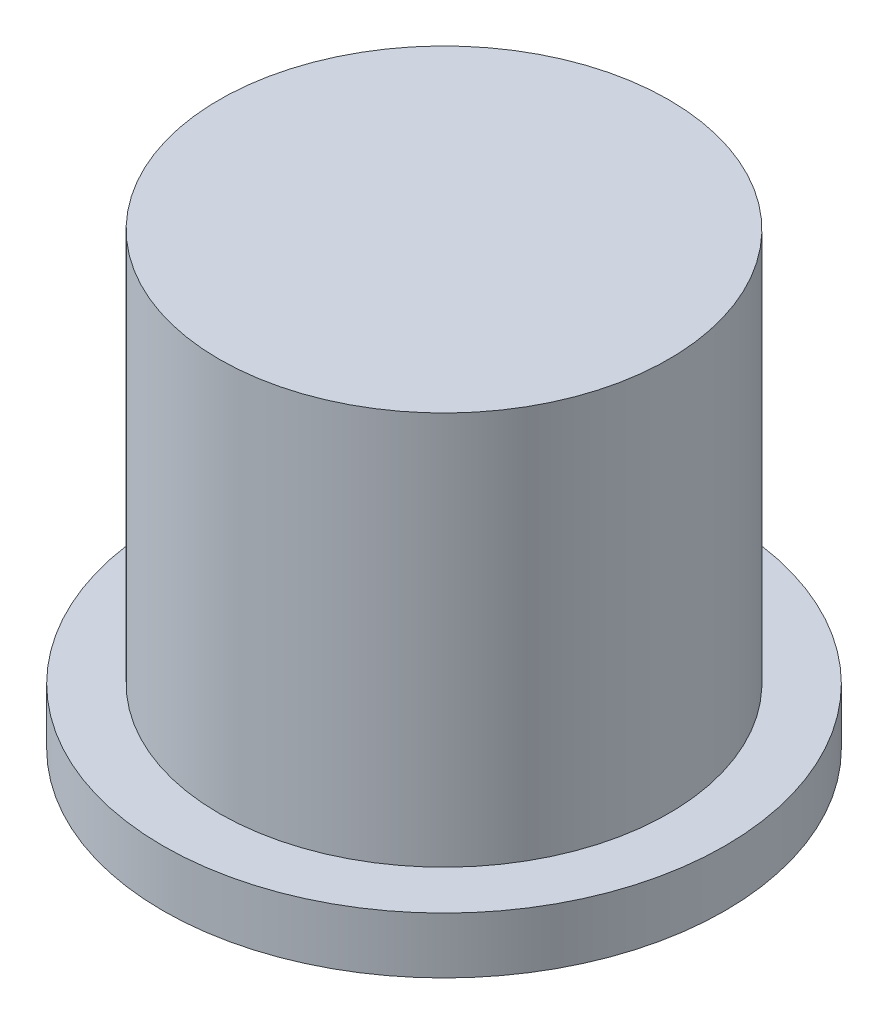
from build123d import *

# Parameters (mm, degrees)
SKETCH1_R           = 10
BOSS_EXTRUDE1_DEPTH = 2
SKETCH2_R           = 8
BOSS_EXTRUDE2_DEPTH = 14


with BuildPart() as part:
    # Sketch1 → Boss-Extrude1 (new body)
    with BuildSketch(Plane(origin=(0, 0, 0), x_dir=(1, 0, 0), z_dir=(0, 1, 0))):
        with Locations(Location((0, 0, 0), (0, 0, 270))):
            Circle(SKETCH1_R)
    extrude(amount=BOSS_EXTRUDE1_DEPTH)

    # Sketch2 → Boss-Extrude2 (add)
    with BuildSketch(Plane(origin=(0, 2, 0), x_dir=(1, 0, 0), z_dir=(0, 1, 0))):
        with Locations(Location((0, 0, 0), (0, 0, 270))):
            Circle(SKETCH2_R)
    extrude(amount=BOSS_EXTRUDE2_DEPTH)


solid = part.part
